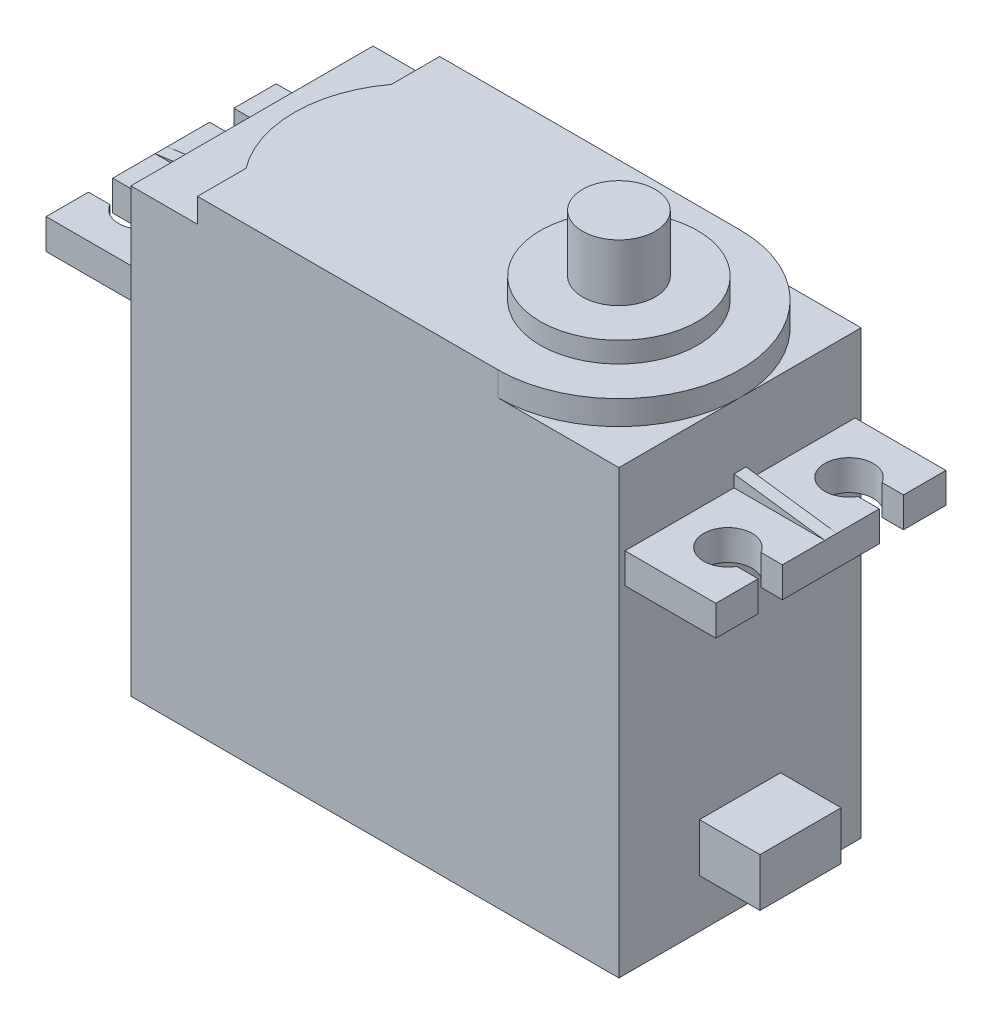
from build123d import *

# Parameters (mm, degrees)
SKETCH1_W                = 40.3
SKETCH1_H                = 20
BOSS_EXTRUDE1_DEPTH      = 36.5
BOSS_EXTRUDE2_DEPTH      = 7.5
BOSS_EXTRUDE2_DEPTH_BACK = 47.8
SKETCH2_W                = 19
SKETCH2_H                = 2.5
CUT_EXTRUDE1_DEPTH       = 7.5
SKETCH5_W                = 7.5
SKETCH5_H                = 1
BOSS_EXTRUDE3_DEPTH      = 1
CUT_EXTRUDE2_DEPTH       = 1
BOSS_EXTRUDE4_DEPTH      = 2
SKETCH8_R                = 6.5
BOSS_EXTRUDE5_DEPTH      = 1.7
SKETCH9_R                = 3
BOSS_EXTRUDE6_DEPTH      = 4.7
SKETCH10_W               = 6.7
SKETCH10_H               = 4
BOSS_EXTRUDE7_DEPTH      = 5


with BuildPart() as part:
    # Sketch1 → Boss-Extrude1 (new body)
    with BuildSketch(Plane(origin=(0, 0, 0), x_dir=(1, 0, 0), z_dir=(0, 1, 0))):
        with Locations((20.15, 10)):
            Rectangle(SKETCH1_W, SKETCH1_H)
    extrude(amount=BOSS_EXTRUDE1_DEPTH)

    # Sketch2 → Boss-Extrude2 (add, two sides: drawn at the far end of the back side and taken through both)
    with BuildSketch(Plane.ZY.offset(-BOSS_EXTRUDE2_DEPTH_BACK)):
        with Locations((-10, 29.05)):
            Rectangle(SKETCH2_W, SKETCH2_H)
    extrude(amount=BOSS_EXTRUDE2_DEPTH + BOSS_EXTRUDE2_DEPTH_BACK)

    # Sketch3 → Cut-Extrude1 (cut)
    with BuildSketch(Plane(origin=(0, 30.3, 0), x_dir=(1, 0, 0), z_dir=(0, 1, 0))):
        with BuildLine():
            Line((-5.732050808, 14), (-5.5, 14))
            Line((-5.5, 14), (-5.5, 16))
            Line((-5.5, 16), (-5.732050808, 16))
            ThreePointArc((-5.732050808, 16), (-6, 15), (-5.732050808, 14))
        make_face()
        with BuildLine():
            Line((-5.5, 16), (-5.5, 14))
            Line((-5.5, 14), (-5.732050808, 14))
            ThreePointArc((-5.732050808, 14), (-3.48236191, 13.068148347), (-2, 15))
            ThreePointArc((-2, 15), (-3.48236191, 16.931851653), (-5.732050808, 16))
            Line((-5.732050808, 16), (-5.5, 16))
        make_face()
        with BuildLine():
            Line((-7.5, 14), (-5.732050808, 14))
            ThreePointArc((-5.732050808, 14), (-6, 15), (-5.732050808, 16))
            Line((-5.732050808, 16), (-7.5, 16))
            Line((-7.5, 16), (-7.5, 14))
        make_face()
        with BuildLine():
            Line((-7.5, 4), (-5.732050808, 4))
            ThreePointArc((-5.732050808, 4), (-6, 5), (-5.732050808, 6))
            Line((-5.732050808, 6), (-7.5, 6))
            Line((-7.5, 6), (-7.5, 4))
        make_face()
        with BuildLine():
            Line((-5.732050808, 4), (-5.5, 4))
            Line((-5.5, 4), (-5.5, 6))
            Line((-5.5, 6), (-5.732050808, 6))
            ThreePointArc((-5.732050808, 6), (-6, 5), (-5.732050808, 4))
        make_face()
        with BuildLine():
            Line((-5.5, 6), (-5.5, 4))
            Line((-5.5, 4), (-5.732050808, 4))
            ThreePointArc((-5.732050808, 4), (-3.48236191, 3.068148347), (-2, 5))
            ThreePointArc((-2, 5), (-3.48236191, 6.931851653), (-5.732050808, 6))
            Line((-5.732050808, 6), (-5.5, 6))
        make_face()
        with BuildLine():
            ThreePointArc((46.032050808, 16), (42.3, 15), (46.032050808, 14))
            Line((46.032050808, 14), (45.8, 14))
            Line((45.8, 14), (45.8, 16))
            Line((45.8, 16), (46.032050808, 16))
        make_face()
        with BuildLine():
            Line((45.8, 14), (46.032050808, 14))
            ThreePointArc((46.032050808, 14), (46.231851653, 14.48236191), (46.3, 15))
            ThreePointArc((46.3, 15), (46.231851653, 15.51763809), (46.032050808, 16))
            Line((46.032050808, 16), (45.8, 16))
            Line((45.8, 16), (45.8, 14))
        make_face()
        with BuildLine():
            Line((46.032050808, 14), (47.8, 14))
            Line((47.8, 14), (47.8, 16))
            Line((47.8, 16), (46.032050808, 16))
            ThreePointArc((46.032050808, 16), (46.231851653, 15.51763809), (46.3, 15))
            ThreePointArc((46.3, 15), (46.231851653, 14.48236191), (46.032050808, 14))
        make_face()
        with BuildLine():
            ThreePointArc((46.032050808, 6), (42.3, 5), (46.032050808, 4))
            Line((46.032050808, 4), (45.8, 4))
            Line((45.8, 4), (45.8, 6))
            Line((45.8, 6), (46.032050808, 6))
        make_face()
        with BuildLine():
            Line((45.8, 4), (46.032050808, 4))
            ThreePointArc((46.032050808, 4), (46.231851653, 4.48236191), (46.3, 5))
            ThreePointArc((46.3, 5), (46.231851653, 5.51763809), (46.032050808, 6))
            Line((46.032050808, 6), (45.8, 6))
            Line((45.8, 6), (45.8, 4))
        make_face()
        with BuildLine():
            Line((46.032050808, 4), (47.8, 4))
            Line((47.8, 4), (47.8, 6))
            Line((47.8, 6), (46.032050808, 6))
            ThreePointArc((46.032050808, 6), (46.231851653, 5.51763809), (46.3, 5))
            ThreePointArc((46.3, 5), (46.231851653, 4.48236191), (46.032050808, 4))
        make_face()
    extrude(amount=-CUT_EXTRUDE1_DEPTH, mode=Mode.SUBTRACT)

    # Sketch5 → Boss-Extrude3 (add)
    with BuildSketch(Plane(origin=(0, 30.3, 0), x_dir=(1, 0, 0), z_dir=(0, 1, 0))):
        with Locations((44.05, 10)):
            Rectangle(SKETCH5_W, SKETCH5_H)
        with Locations((-3.75, 10)):
            Rectangle(SKETCH5_W, SKETCH5_H)
    extrude(amount=BOSS_EXTRUDE3_DEPTH)

    # Sketch6 → Cut-Extrude2 (cut)
    with BuildSketch(Plane.XY.offset(-9.5)):
        Polygon((0, 31.3), (-7.5, 31.3), (-7.5, 30.3), align=None)
        Polygon((47.8, 30.3), (40.3, 31.3), (47.8, 31.3), align=None)
    extrude(amount=-CUT_EXTRUDE2_DEPTH, mode=Mode.SUBTRACT)

    # Sketch7 → Boss-Extrude4 (add)
    with BuildSketch(Plane(origin=(0, 36.5, 0), x_dir=(1, 0, 0), z_dir=(0, 1, 0))):
        with BuildLine():
            Line((30.3, 20), (13.5, 20))
            ThreePointArc((13.5, 20), (9.027864045, 18.94427191), (5.5, 16))
            Line((5.5, 16), (5.5, 4))
            ThreePointArc((5.5, 4), (9.027864045, 1.05572809), (13.5, 0))
            Line((13.5, 0), (30.3, 0))
            Line((30.3, 0), (30.3, 20))
        make_face()
        with BuildLine():
            Line((5.5, 4), (5.5, 16))
            ThreePointArc((5.5, 16), (3.5, 10), (5.5, 4))
        make_face()
        with BuildLine():
            Line((13.5, 20), (5.5, 20))
            Line((5.5, 20), (5.5, 16))
            ThreePointArc((5.5, 16), (9.027864045, 18.94427191), (13.5, 20))
        make_face()
        with BuildLine():
            ThreePointArc((13.5, 0), (9.027864045, 1.05572809), (5.5, 4))
            Line((5.5, 4), (5.5, 0))
            Line((5.5, 0), (13.5, 0))
        make_face()
        with BuildLine():
            ThreePointArc((30.3, 20), (40.3, 10), (30.3, 0))
            Line((30.3, 0), (30.3, 20))
        make_face()
    extrude(amount=BOSS_EXTRUDE4_DEPTH)

    # Sketch8 → Boss-Extrude5 (add)
    with BuildSketch(Plane(origin=(0, 38.5, 0), x_dir=(1, 0, 0), z_dir=(0, 1, 0))):
        with Locations(Location((30.3, 10, 0), (0, 0, 270))):
            Circle(SKETCH8_R)
    extrude(amount=BOSS_EXTRUDE5_DEPTH)

    # Sketch9 → Boss-Extrude6 (add)
    with BuildSketch(Plane(origin=(0, 40.2, 0), x_dir=(1, 0, 0), z_dir=(0, 1, 0))):
        with Locations(Location((30.3, 10, 0), (0, 0, 270))):
            Circle(SKETCH9_R)
    extrude(amount=BOSS_EXTRUDE6_DEPTH)

    # Sketch10 → Boss-Extrude7 (add)
    with BuildSketch(Plane(origin=(40.3, 0, 0), x_dir=(0, 0, -1), z_dir=(1, 0, 0))):
        with Locations((10, 6)):
            Rectangle(SKETCH10_W, SKETCH10_H)
    extrude(amount=BOSS_EXTRUDE7_DEPTH)


solid = part.part
